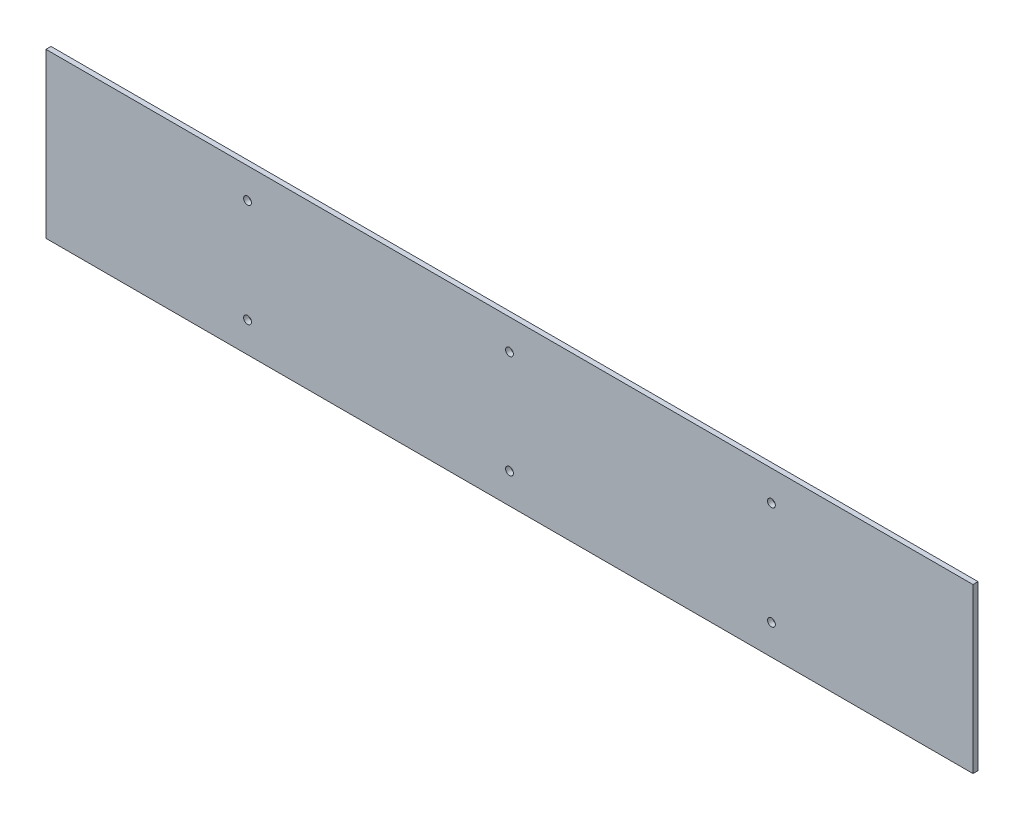
from build123d import *

# Parameters (mm, degrees)
SKETCH2_W                    = 584.2
SKETCH2_H                    = 103.1875
BOSS_EXTRUDE1_DEPTH          = 3.175
F_10_0_1935_DIAMETER_HOLE1_D = 4.9149


with BuildPart() as part:
    # Sketch2 → Boss-Extrude1 (new body)
    with BuildSketch(Plane.XY):
        with Locations((292.1, 51.59375)):
            Rectangle(SKETCH2_W, SKETCH2_H)
    extrude(amount=BOSS_EXTRUDE1_DEPTH)

    # #10 (0.1935) Diameter Hole1 (through all)
    with Locations(Plane.XY.offset(3.175)):
        with Locations((127, 84.1375), (292.1, 84.1375), (457.2, 84.1375)):
            f_10_0_1935_diameter_hole1 = Hole(F_10_0_1935_DIAMETER_HOLE1_D / 2)

    # Mirror1: #10 (0.1935) Diameter Hole1 across plane
    add(f_10_0_1935_diameter_hole1.mirror(Plane.ZX.offset(51.59375)), mode=Mode.SUBTRACT)


solid = part.part
